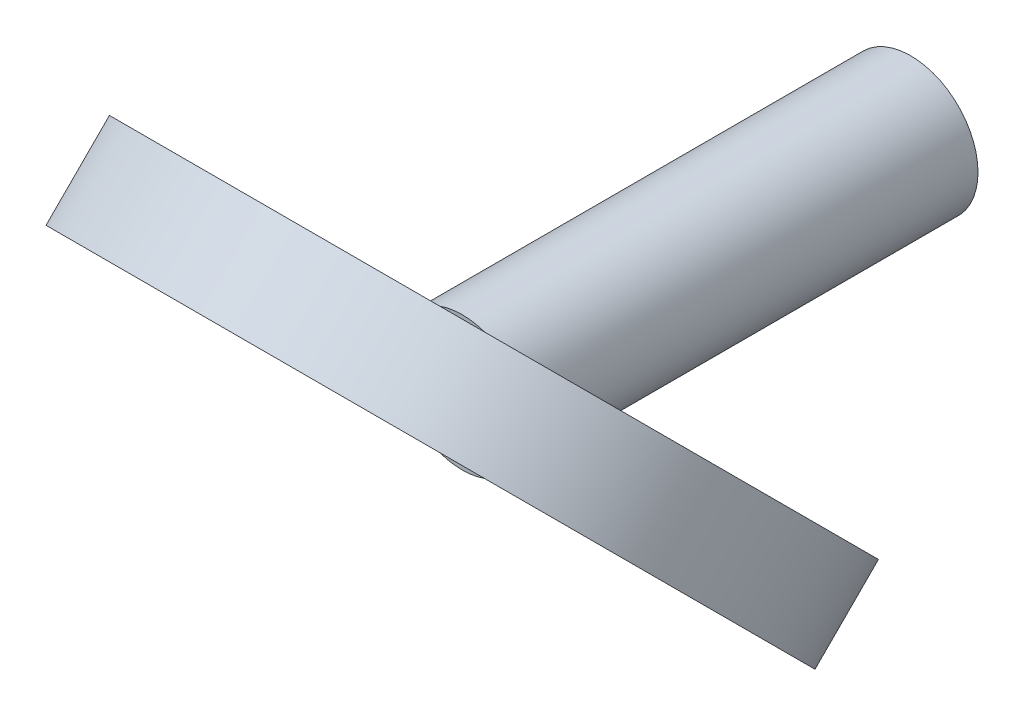
from build123d import *

# Parameters (mm, degrees)
SKETCH1_R           = 7.5
BOSS_EXTRUDE1_DEPTH = 50
SKETCH3_R           = 35
BOSS_EXTRUDE2_DEPTH = 5
SKETCH4_R           = 2.5
CUT_EXTRUDE1_DEPTH  = 5


with BuildPart() as part:
    # Sketch1 → Boss-Extrude1 (new body)
    with BuildSketch(Plane.XY):
        Circle(SKETCH1_R)
    extrude(amount=-BOSS_EXTRUDE1_DEPTH)

    # Sketch3 → Boss-Extrude2 (add, symmetric)
    with BuildSketch(Plane(origin=(0, 0, 0), x_dir=(1, 0, 0), z_dir=(0, -0.7071067811865475, 0.7071067811865477))):
        with Locations(Location((0, 0, 0), (0, 0, 270))):
            Circle(SKETCH3_R)
    extrude(amount=BOSS_EXTRUDE2_DEPTH, both=True)

    # Sketch4 → Cut-Extrude1 (cut)
    with BuildSketch(Plane(origin=(0, 0, -50), x_dir=(-1, 0, 0), z_dir=(0, 0, -1))):
        Circle(SKETCH4_R)
    extrude(amount=-CUT_EXTRUDE1_DEPTH, mode=Mode.SUBTRACT)


solid = part.part
